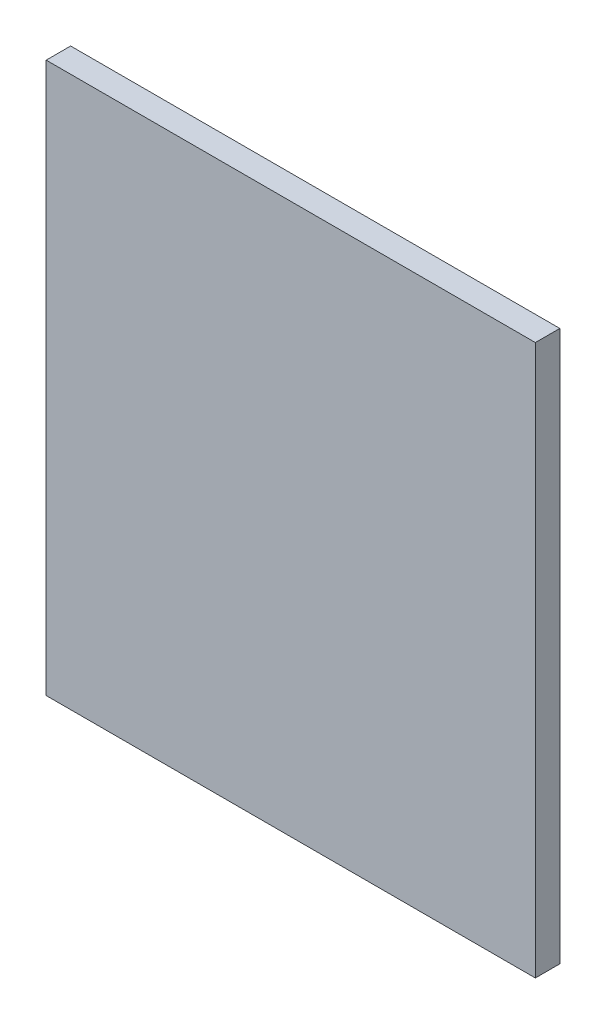
from build123d import *

# Parameters (mm, degrees)
EXTRUDE_1_DEPTH      = 0.8
EXTRUDE_1_DEPTH_BACK = 0.8
SKETCH_1_W           = 32
SKETCH_1_H           = 36


with BuildPart() as part:
    # 草图1 → 凸台-拉伸1 (new, two sides: drawn at the far end of the back side and taken through both)
    with BuildSketch(Plane.XY.offset(-EXTRUDE_1_DEPTH_BACK)):
        with Locations((-41.5, -14.4)):
            Rectangle(SKETCH_1_W, SKETCH_1_H)
    extrude(amount=EXTRUDE_1_DEPTH + EXTRUDE_1_DEPTH_BACK)


solid = part.part
